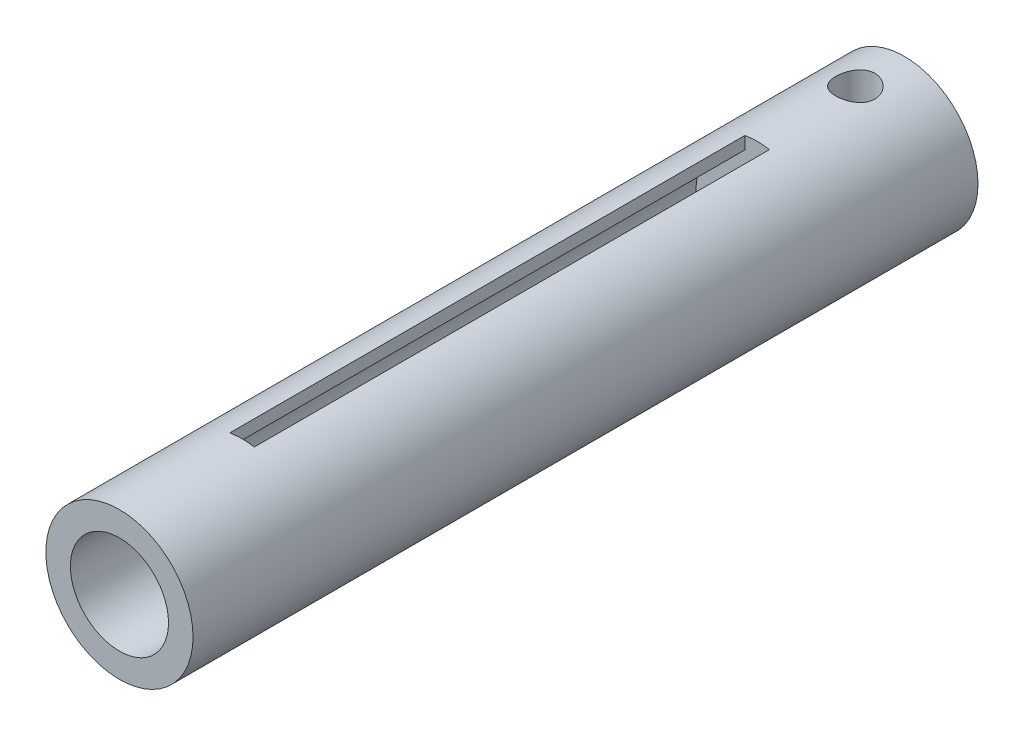
from build123d import *

# Parameters (mm, degrees)
BOSS_EXTRUDE1_DEPTH      = 150
BOSS_EXTRUDE1_DEPTH_BACK = 10
SKETCH1_R                = 15
SKETCH3_R                = 12.5
CUT_EXTRUDE2_DEPTH       = 105
CUT_EXTRUDE3_REACH       = 163.4
SKETCH4_R                = 10
CUT_EXTRUDE4_DEPTH       = 152.492574075
CUT_EXTRUDE4_DEPTH_BACK  = 152.492574075
SKETCH5_R                = 4
SKETCH6_W                = 5
SKETCH6_H                = 105
CUT_EXTRUDE12_DEPTH      = 152.492574194


with BuildPart() as part:
    # Sketch1 → Boss-Extrude1 (new, two sides: drawn at the far end of the back side and taken through both)
    with BuildSketch(Plane.XY.offset(-BOSS_EXTRUDE1_DEPTH_BACK)):
        Circle(SKETCH1_R)
    extrude(amount=BOSS_EXTRUDE1_DEPTH + BOSS_EXTRUDE1_DEPTH_BACK)

    # Sketch3 → Cut-Extrude2 (cut)
    with BuildSketch(Plane.XY.offset(125)):
        Circle(SKETCH3_R)
    extrude(amount=-CUT_EXTRUDE2_DEPTH, mode=Mode.SUBTRACT)

    # Sketch4 → Cut-Extrude3 (cut, up to next)
    with BuildSketch(Plane.XY.offset(150), mode=Mode.PRIVATE) as cut_extrude3_sk1:
        Circle(SKETCH4_R)
    cut_extrude3_tool1 = extrude(cut_extrude3_sk1.sketch, amount=-CUT_EXTRUDE3_REACH, mode=Mode.PRIVATE) & part.part
    add(cut_extrude3_tool1.solids().sort_by_distance((0, 0, 150))[0], mode=Mode.SUBTRACT)

    # Sketch5 → Cut-Extrude4 (cut, two sides: drawn at the far end of the back side and taken through both)
    with BuildSketch(Plane(origin=(0, 0, 0), x_dir=(1, 0, 0), z_dir=(0, 1, 0)).offset(-CUT_EXTRUDE4_DEPTH_BACK)):
        with Locations(Location((0, 0, 0), (0, 0, 270))):
            Circle(SKETCH5_R)
    extrude(amount=CUT_EXTRUDE4_DEPTH + CUT_EXTRUDE4_DEPTH_BACK, mode=Mode.SUBTRACT)

    # Sketch6 → Cut-Extrude12 (cut, through all)
    with BuildSketch(Plane(origin=(0, 0, 0), x_dir=(1, 0, 0), z_dir=(0, 1, 0))):
        with Locations((0, -72.5)):
            Rectangle(SKETCH6_W, SKETCH6_H)
    extrude(amount=CUT_EXTRUDE12_DEPTH, mode=Mode.SUBTRACT)


solid = part.part
